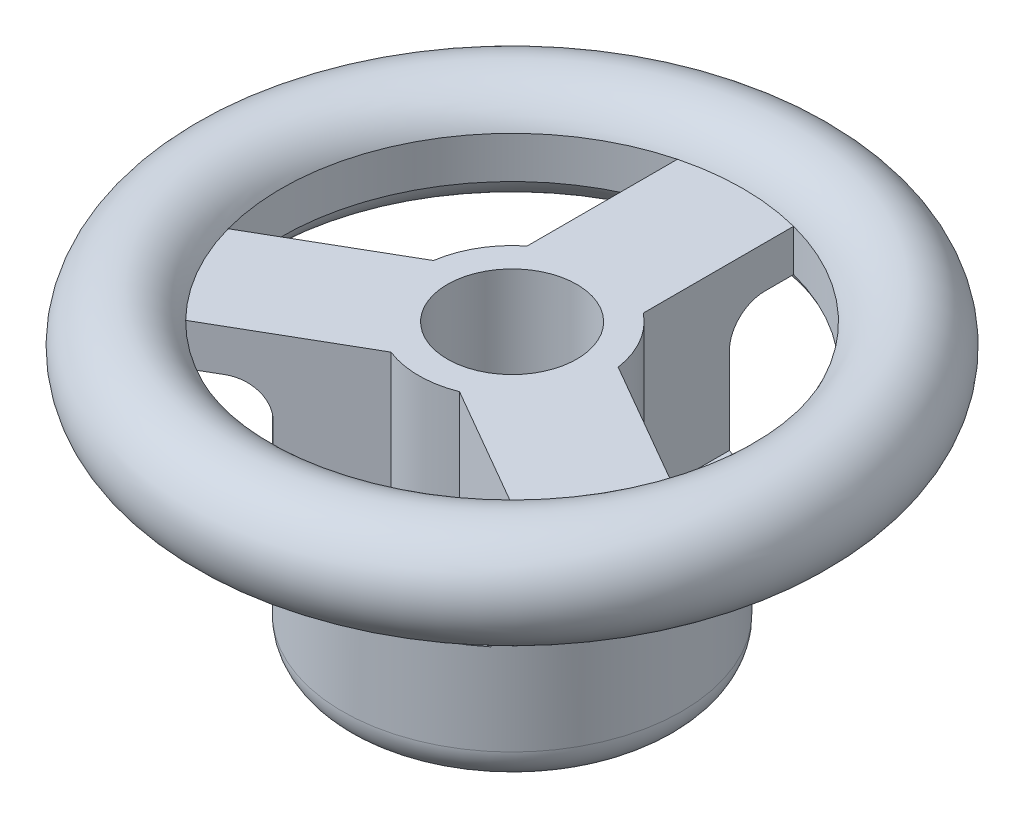
from build123d import *

# Parameters (mm, degrees)
SKETCH2_R           = 1.55
CUT_EXTRUDE5_DEPTH  = 14.87
CUT_EXTRUDE10_DEPTH = 3.88
SKETCH5_R           = 3.26
CUT_EXTRUDE11_DEPTH = 2.18


with BuildPart() as part:
    # Sketch1 → Revolve1 (revolve)
    with BuildSketch(Plane.XY):
        with BuildLine():
            Line((0, 0.5), (5.525741394, 0.5))
            ThreePointArc((5.525741394, 0.5), (7.89, 0), (5.525741394, -0.5))
            Line((5.525741394, -0.5), (4.86, -0.5))
            ThreePointArc((4.86, -0.5), (4.294314575, -0.734314575), (4.06, -1.3))
            Line((4.06, -1.3), (4.06, -5.55))
            ThreePointArc((4.06, -5.55), (3.825685425, -6.115685425), (3.26, -6.35))
            Line((3.26, -6.35), (0, -6.35))
            Line((0, -6.35), (0, 0))
            Line((0, 0), (0, 0.5))
        make_face()
    revolve(axis=Axis((0, 0, 0), (0, 1, 0)))

    # Sketch2 → Cut-Extrude5 (cut)
    with BuildSketch(Plane(origin=(0, 0.5, 0), x_dir=(1, 0, 0), z_dir=(0, 1, 0))):
        with Locations(Location((0, 0, 0), (0, 0, 180))):
            Circle(SKETCH2_R)
    extrude(amount=-CUT_EXTRUDE5_DEPTH, mode=Mode.SUBTRACT)

    # Sketch3 → Cut-Extrude10 (cut)
    with BuildSketch(Plane(origin=(0, 0.5, 0), x_dir=(1, 0, 0), z_dir=(0, 1, 0))):
        with BuildLine():
            ThreePointArc((-2.210699096, 0.32868603), (-1.935566777, 1.1175), (-1.39, 1.750178562))
            Line((-1.39, 1.750178562), (-1.39, 5.3480574))
            ThreePointArc((-1.39, 5.3480574), (-4.785432422, 2.762870697), (-5.326553569, -1.470253389))
            Line((-5.326553569, -1.470253389), (-2.210699096, 0.32868603))
        make_face()
        with BuildLine():
            Line((1.39, 5.3480574), (1.39, 1.750178562))
            ThreePointArc((1.39, 1.750178562), (1.935566777, 1.1175), (2.210699096, 0.32868603))
            Line((2.210699096, 0.32868603), (5.326553569, -1.470253389))
            ThreePointArc((5.326553569, -1.470253389), (5.475718012, -0.741842439), (5.525741394, 0))
            ThreePointArc((5.525741394, 0), (4.371189683, 3.380313404), (1.39, 5.3480574))
        make_face()
        with BuildLine():
            ThreePointArc((0.820699096, -2.078864592), (0, -2.235), (-0.820699096, -2.078864592))
            Line((-0.820699096, -2.078864592), (-3.936553569, -3.877804011))
            ThreePointArc((-3.936553569, -3.877804011), (0, -5.525741394), (3.936553569, -3.877804011))
            Line((3.936553569, -3.877804011), (0.820699096, -2.078864592))
        make_face()
    extrude(amount=-CUT_EXTRUDE10_DEPTH, mode=Mode.SUBTRACT)

    # Sketch5 → Cut-Extrude11 (cut)
    with BuildSketch(Plane.XZ.offset(6.35)):
        Circle(SKETCH5_R)
    extrude(amount=-CUT_EXTRUDE11_DEPTH, mode=Mode.SUBTRACT)


solid = part.part
